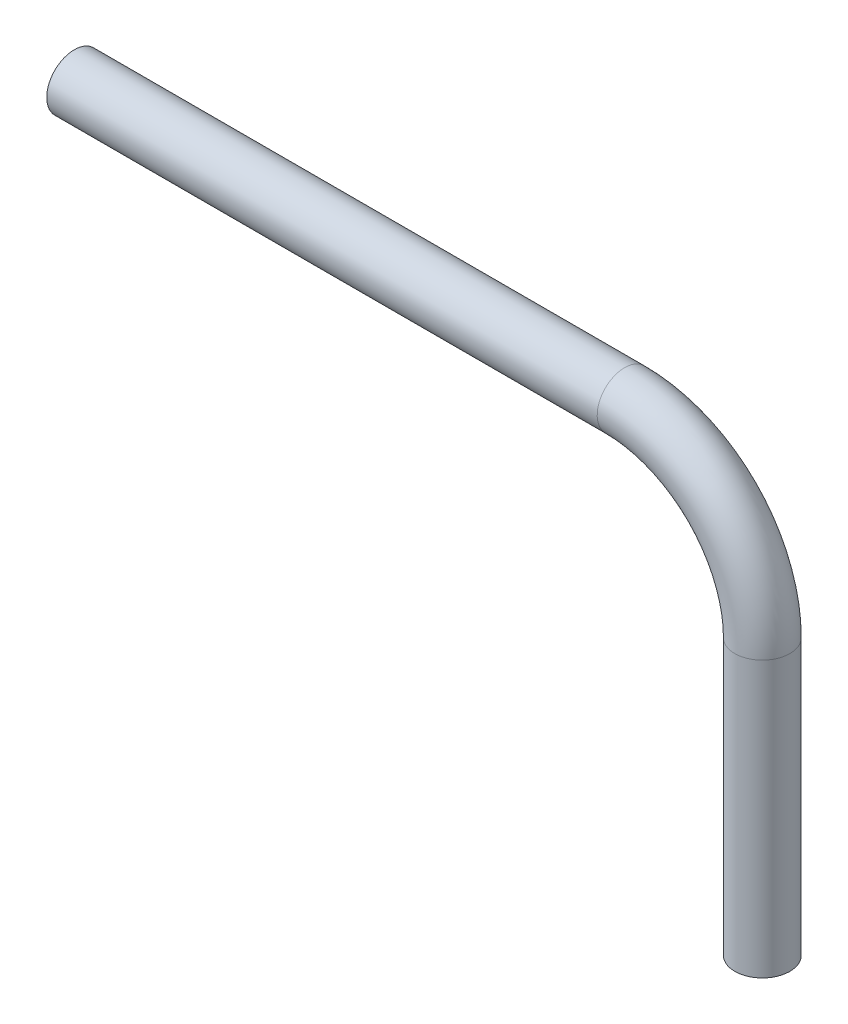
from build123d import *

# Parameters (mm, degrees)
SKETCH2_R = 5


with BuildPart() as part:
    # Sweep1: sweep along a path in Sketch1
    with BuildLine(Plane.XY) as sweep1_path:
        Line((0, 0), (100, 0))
        ThreePointArc((100, 0), (117.67766953, -7.32233047), (125, -25))
        Line((125, -25), (125, -75))
    # Sketch2 → Sweep1 (sweep)
    with BuildSketch(Plane(origin=(0, 0, 0), x_dir=(0, 0, -1), z_dir=(1, 0, 0))):
        Circle(SKETCH2_R)
    sweep(path=sweep1_path.line)


solid = part.part
